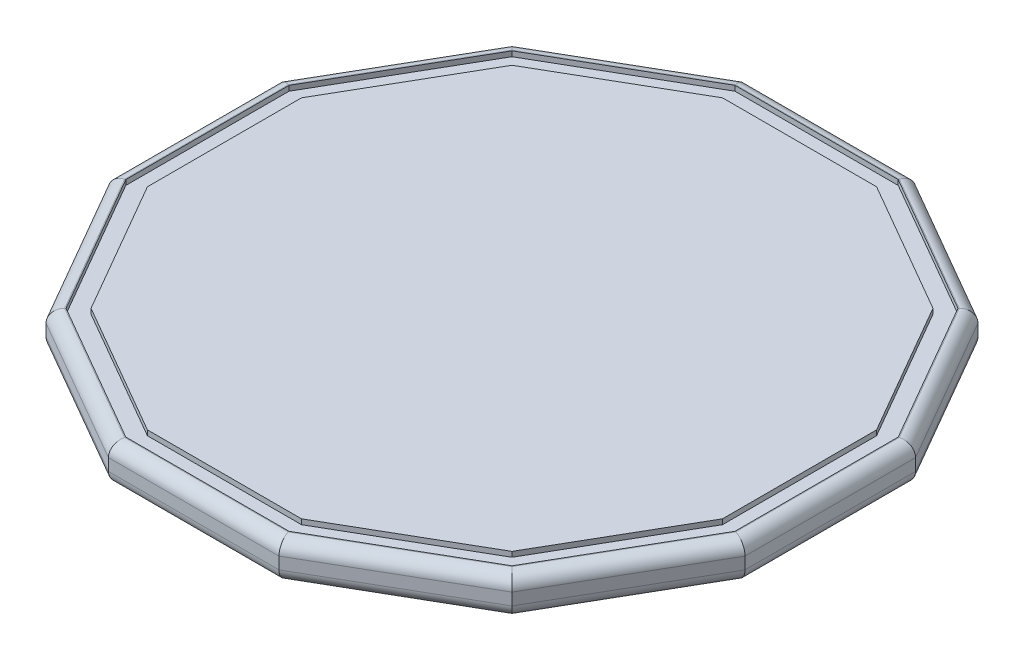
from build123d import *

# Parameters (mm, degrees)
EXTRUDE_1_DEPTH          = 4.4
CUT_EXTRUDE_1_DEPTH      = 0.6
FILLET_1_R               = 1.5
SKETCH_3_W               = 20
SKETCH_3_H               = 15
EXTRUDE_2_DEPTH          = 10
SKETCH_4_W               = 20
SKETCH_4_H               = 5.2
CUT_EXTRUDE_2_DEPTH      = 10
CUT_EXTRUDE_3_DEPTH      = 60.123345338
CUT_EXTRUDE_3_DEPTH_BACK = 60.123345338
SKETCH_5_R               = 1.6


with BuildPart() as part:
    # 스케치1 → 보스-돌출1 (new body)
    with BuildSketch(Plane(origin=(0, 0, 0), x_dir=(1, 0, 0), z_dir=(0, 1, 0))):
        Polygon((27.293187568, -27.293187568), (37.283187568, -9.99), (37.283187568, 9.99), (27.293187568, 27.293187568), (9.99, 37.283187568), (-9.99, 37.283187568), (-27.293187568, 27.293187568), (-37.283187568, 9.99), (-37.283187568, -9.99), (-27.293187568, -27.293187568), (-9.99, -37.283187568), (9.99, -37.283187568), align=None)
    extrude(amount=EXTRUDE_1_DEPTH)

    # 스케치2 → 컷-돌출1 (cut)
    with BuildSketch(Plane(origin=(0, 4.4, 0), x_dir=(1, 0, 0), z_dir=(0, 1, 0))):
        Polygon((-26.120860153, 26.120860153), (-35.681758538, 9.560898385), (-35.681758538, -9.560898385), (-26.120860153, -26.120860153), (-9.560898385, -35.681758538), (9.560898385, -35.681758538), (26.120860153, -26.120860153), (35.681758538, -9.560898385), (35.681758538, 9.560898385), (26.120860153, 26.120860153), (9.560898385, 35.681758538), (-9.560898385, 35.681758538), align=None)
        Polygon((24.656758538, -24.656758538), (33.681758538, -9.025), (33.681758538, 9.025), (24.656758538, 24.656758538), (9.025, 33.681758538), (-9.025, 33.681758538), (-24.656758538, 24.656758538), (-33.681758538, 9.025), (-33.681758538, -9.025), (-24.656758538, -24.656758538), (-9.025, -33.681758538), (9.025, -33.681758538), align=None, mode=Mode.SUBTRACT)
    extrude(amount=-CUT_EXTRUDE_1_DEPTH, mode=Mode.SUBTRACT)

    # 필렛1
    fillet_1_edges = [part.edges().sort_by_distance(p)[0] for p in [
        (0, 0, 37.283187568),
        (-18.641593784, 0, 32.288187568),
        (37.283187568, 4.4, 0),
        (-32.288187568, 0, 18.641593784),
        (-37.283187568, 0, 0),
        (-32.288187568, 0, -18.641593784),
        (-18.641593784, 0, -32.288187568),
        (0, 0, -37.283187568),
        (18.641593784, 0, -32.288187568),
        (32.288187568, 0, -18.641593784),
        (37.283187568, 0, 0),
        (32.288187568, 0, 18.641593784),
        (18.641593784, 0, 32.288187568),
        (32.288187568, 4.4, -18.641593784),
        (18.641593784, 4.4, -32.288187568),
        (0, 4.4, -37.283187568),
        (-18.641593784, 4.4, -32.288187568),
        (-32.288187568, 4.4, -18.641593784),
        (-37.283187568, 4.4, 0),
        (-32.288187568, 4.4, 18.641593784),
        (-18.641593784, 4.4, 32.288187568),
        (0, 4.4, 37.283187568),
        (18.641593784, 4.4, 32.288187568),
        (32.288187568, 4.4, 18.641593784),
    ]]
    fillet(fillet_1_edges, radius=FILLET_1_R)

    # 스케치3 → 보스-돌출2 (add)
    with BuildSketch(Plane.XZ):
        Rectangle(SKETCH_3_W, SKETCH_3_H)
    extrude(amount=EXTRUDE_2_DEPTH)

    # 스케치4 → 컷-돌출2 (cut)
    with BuildSketch(Plane.XZ.offset(10)):
        Rectangle(SKETCH_4_W, SKETCH_4_H)
    extrude(amount=-CUT_EXTRUDE_2_DEPTH, mode=Mode.SUBTRACT)

    # 스케치5 → 컷-돌출3 (cut, two sides: drawn at the far end of the back side and taken through both)
    with BuildSketch(Plane(origin=(0, 0, -7.5), x_dir=(-1, 0, 0), z_dir=(0, 0, -1)).offset(-CUT_EXTRUDE_3_DEPTH_BACK)):
        with Locations((-5, -5)):
            Circle(SKETCH_5_R)
        with Locations((5, -5)):
            Circle(SKETCH_5_R)
    extrude(amount=CUT_EXTRUDE_3_DEPTH + CUT_EXTRUDE_3_DEPTH_BACK, mode=Mode.SUBTRACT)


solid = part.part
